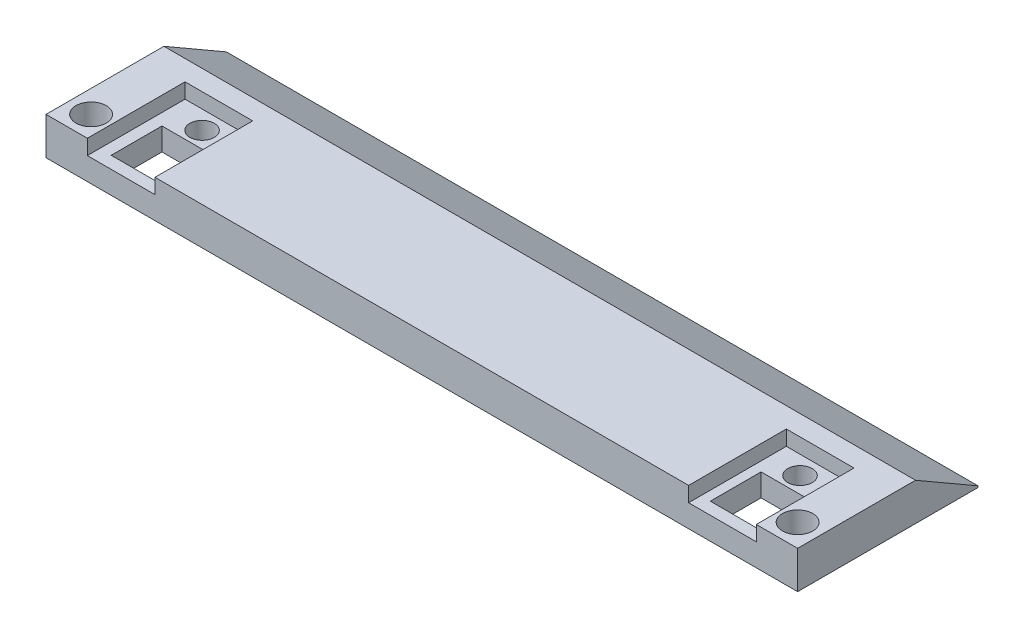
from build123d import *

# Parameters (mm, degrees)
CROQUIS1_W                 = 100
CROQUIS1_H                 = 24
CROQUIS1_R                 = 2.017504942
CROQUIS1_W_2               = 5.897168216
CROQUIS1_H_2               = 6.754663932
CROQUIS1_W_3               = 6.477766384
SALIENTE_EXTRUIR1_DEPTH    = 5
CROQUIS2_W                 = 9
CROQUIS2_H                 = 13
CROQUIS2_R                 = 2.5
CORTAR_EXTRUIR1_DEPTH      = 2
CORTAR_EXTRUIR5_DEPTH      = 141
CORTAR_EXTRUIR6_DEPTH      = 21
CORTAR_EXTRUIR6_DEPTH_BACK = 26
CROQUIS5_R                 = 1.626798587


with BuildPart() as part:
    # Croquis1 → Saliente-Extruir1 (new body)
    with BuildSketch(Plane(origin=(0, 0, 0), x_dir=(1, 0, 0), z_dir=(0, 1, 0))):
        Rectangle(CROQUIS1_W, CROQUIS1_H)
        with Locations(Location((-47, -9, 0), (0, 0, 270))):
            Circle(CROQUIS1_R, mode=Mode.SUBTRACT)
        with Locations(Location((47, -9, 0), (0, 0, 270))):
            Circle(CROQUIS1_R, mode=Mode.SUBTRACT)
        with Locations((-40, -7)):
            Rectangle(CROQUIS1_W_2, CROQUIS1_H_2, mode=Mode.SUBTRACT)
        with Locations((40, -7)):
            Rectangle(CROQUIS1_W_3, CROQUIS1_H_2, mode=Mode.SUBTRACT)
    extrude(amount=SALIENTE_EXTRUIR1_DEPTH)

    # Croquis2 → Cortar-Extruir1 (cut)
    # profile 1 of 2: a face of its own
    with BuildSketch(Plane(origin=(0, 5, 0), x_dir=(1, 0, 0), z_dir=(0, 1, 0))):
        with Locations((-40, -5.5)):
            Rectangle(CROQUIS2_W, CROQUIS2_H)
        with Locations((-40, -7)):
            Circle(CROQUIS2_R, mode=Mode.SUBTRACT)
    # profile 2 of 2: a face of its own
    with BuildSketch(Plane(origin=(0, 5, 0), x_dir=(1, 0, 0), z_dir=(0, 1, 0))):
        with Locations((40, -5.5)):
            Rectangle(CROQUIS2_W, CROQUIS2_H)
        with Locations((40, -7)):
            Circle(CROQUIS2_R, mode=Mode.SUBTRACT)
    extrude(amount=-CORTAR_EXTRUIR1_DEPTH, mode=Mode.SUBTRACT)

    # Croquis3 → Cortar-Extruir5 (cut)
    with BuildSketch(Plane.ZY.offset(50)):
        Polygon((-12, 5), (-12, 0.2), (-6.100895765, 3.605849418), (-3.686156124, 5), align=None)
        Polygon((-12.757171087, 0.2), (-12, 0.2), (-12, 5), (-3.686156124, 5), (-3.039853353, 5.373143079), (-12.757171087, 5.373143079), align=None)
    extrude(amount=-CORTAR_EXTRUIR5_DEPTH, mode=Mode.SUBTRACT)

    # Croquis5 → Cortar-Extruir6 (cut, two sides: drawn at the far end of the back side and taken through both)
    with BuildSketch(Plane(origin=(0, 3, 0), x_dir=(1, 0, 0), z_dir=(0, 1, 0)).offset(-CORTAR_EXTRUIR6_DEPTH_BACK)):
        with Locations(Location((39.778371373, -1.459300721, 0), (0, 0, 270))):
            Circle(CROQUIS5_R)
        with Locations(Location((-39.778371373, -1.459300721, 0), (0, 0, 270))):
            Circle(CROQUIS5_R)
    extrude(amount=CORTAR_EXTRUIR6_DEPTH + CORTAR_EXTRUIR6_DEPTH_BACK, mode=Mode.SUBTRACT)


solid = part.part
